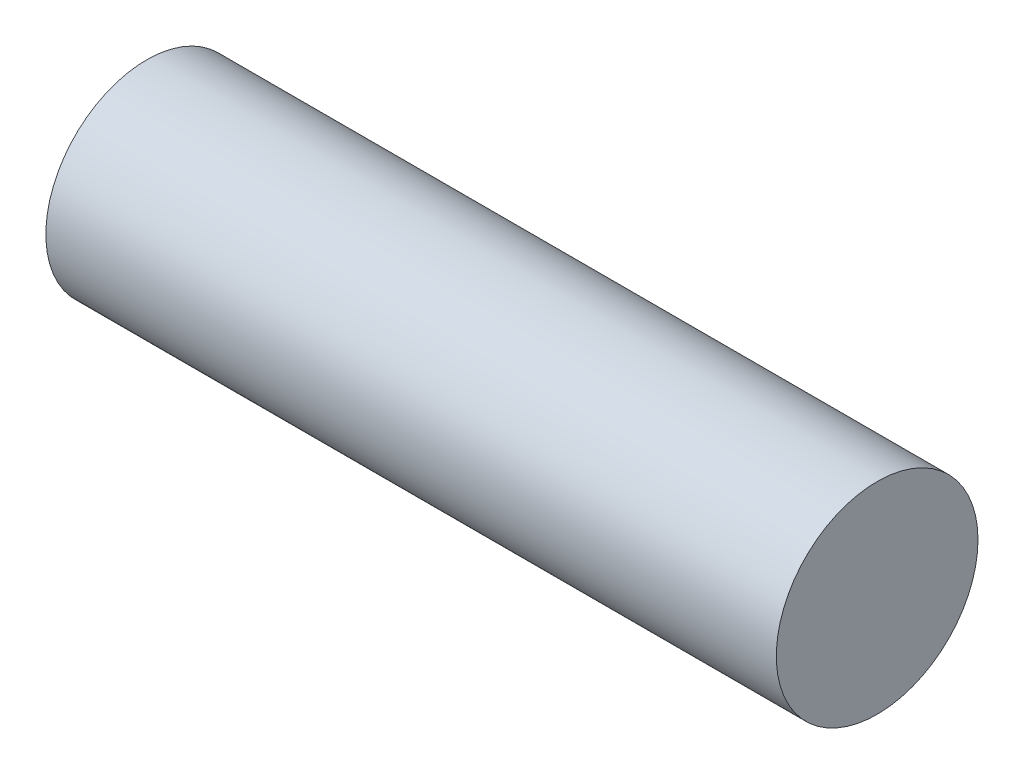
from build123d import *

# Parameters (mm, degrees)
ESBO_O1_R                = 9.25
RESSALTO_EXTRUS_O1_DEPTH = 67


with BuildPart() as part:
    # Esboço1 → Ressalto-extrusão1 (new body)
    with BuildSketch(Plane(origin=(0, 0, 0), x_dir=(0, 0, -1), z_dir=(1, 0, 0))):
        Circle(ESBO_O1_R)
    extrude(amount=-RESSALTO_EXTRUS_O1_DEPTH)


solid = part.part
